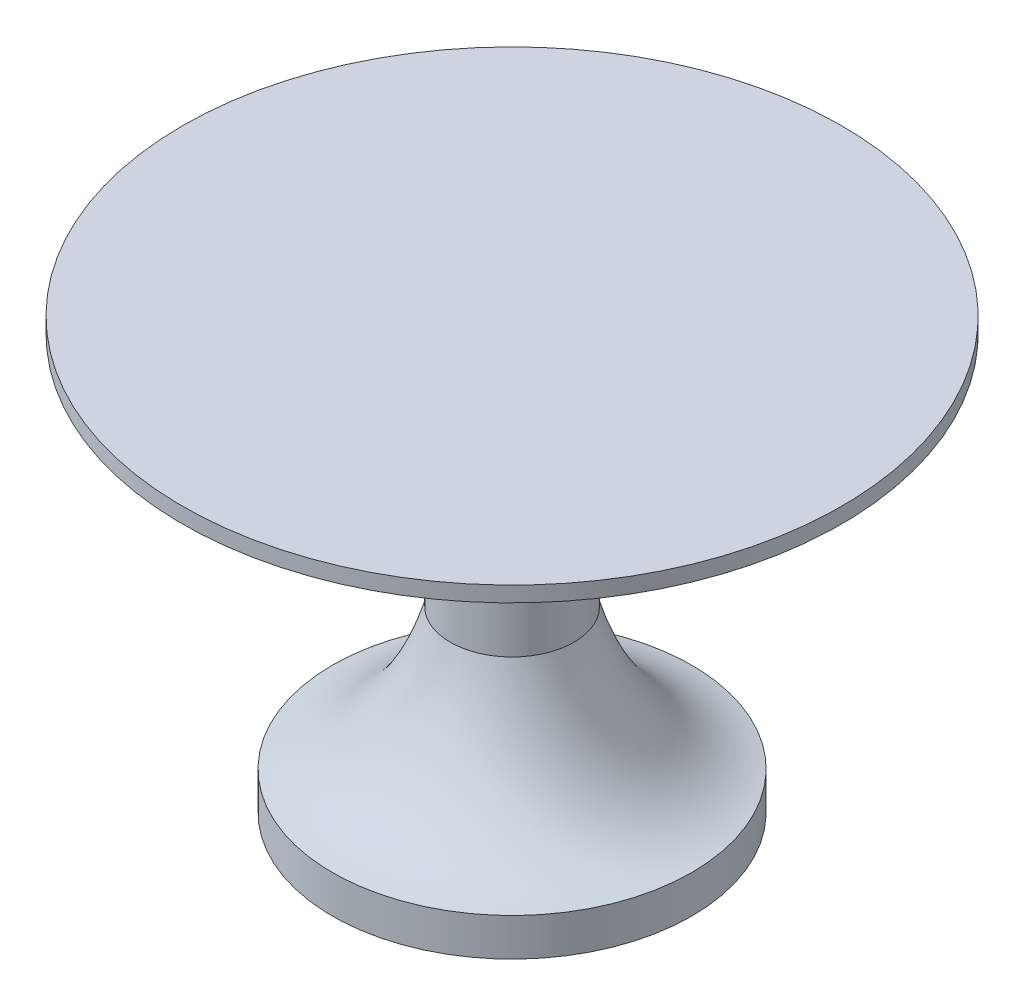
from build123d import *

# Parameters (mm, degrees)
SKETCH2_W = 609.6
SKETCH2_H = 28.575


with BuildPart() as part:
    # Sketch2 → Revolve1 (revolve)
    with BuildSketch(Plane.XY, mode=Mode.PRIVATE) as revolve1_sk:
        Polygon((114.390414377, 0), (0, 0), (0, -508), (57.195207189, -508), (114.390414377, -508), (114.390414377, -436.856929751), align=None)
        with Locations((304.8, 14.2875)):
            Rectangle(SKETCH2_W, SKETCH2_H)
        with BuildLine():
            add(Edge.make_bspline(
                [(114.390414377, -436.856929751), (144.884830942, -546.818476347), (207.101707678, -672.816275805), (332.316500716, -696.853289197)],
                knots=[0, 0, 0, 0, 1, 1, 1, 1], degree=3))
            Line((114.390414377, -436.856929751), (114.390414377, -508))
            Line((114.390414377, -508), (57.195207189, -508))
            add(Edge.make_bspline(
                [(332.316500716, -766.703289197), (180.787832632, -766.227742439), (148.104498186, -589.357090779), (57.195207189, -508)],
                knots=[0, 0, 0, 0, 1, 1, 1, 1], degree=3))
            Line((332.316500716, -766.703289197), (332.316500716, -696.853289197))
        make_face()
    revolve(revolve1_sk.sketch.rotate(Axis((0, 0, 0), (0, -1, 0)), 180), axis=Axis((0, 0, 0), (0, -1, 0)))


solid = part.part
